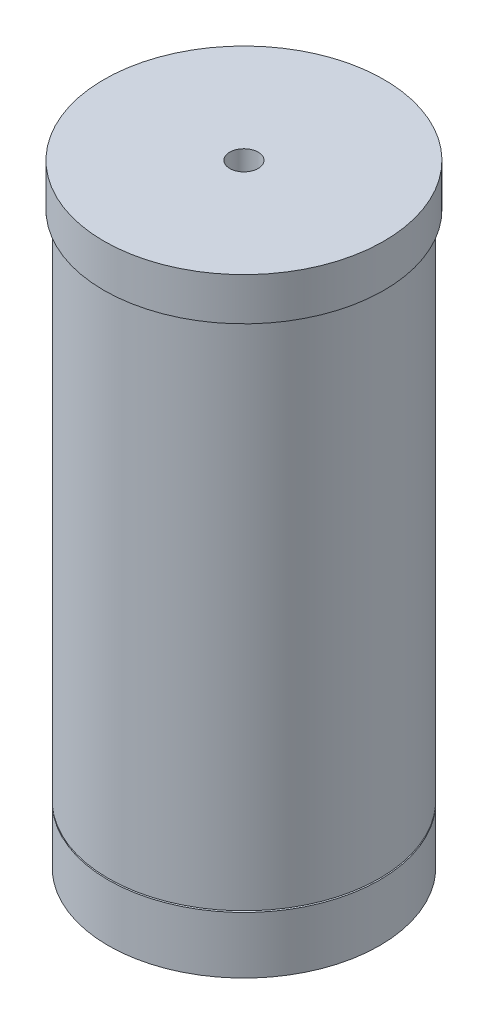
from build123d import *

# Parameters (mm, degrees)
SKETCH1_R             = 47.75
SKETCH1_R_2           = 5
SKETCH1_R_3           = 6
BOSS_EXTRUDE1_DEPTH   = 45
SKETCH1_3_R           = 11.5
SKETCH1_3_R_2         = 8.5
CUT_EXTRUDE1_DEPTH    = 5
SKETCH3_R             = 47.75
SKETCH3_R_2           = 5
BOSS_EXTRUDE2_DEPTH   = 10
SKETCH6_R             = 47.75
SKETCH6_R_2           = 42.5
BOSS_EXTRUDE6_DEPTH   = 125
BOSS_EXTRUDE7_DEPTH   = 20
SKETCH7_R             = 11.25
SKETCH7_R_2           = 8.75
BOSS_EXTRUDE8_DEPTH   = 2
BOSS_EXTRUDE8_2_DEPTH = 2
BOSS_EXTRUDE8_3_DEPTH = 2
BOSS_EXTRUDE8_4_DEPTH = 2
BOSS_EXTRUDE8_5_DEPTH = 2
BOSS_EXTRUDE8_6_DEPTH = 2
BOSS_EXTRUDE8_7_DEPTH = 2
BOSS_EXTRUDE8_8_DEPTH = 2
BOSS_EXTRUDE9_START   = -20
SKETCH7_4_R           = 47.75
BOSS_EXTRUDE9_DEPTH   = 20
SKETCH8_R             = 49.28
SKETCH8_R_2           = 5
BOSS_EXTRUDE10_DEPTH  = 15
BOSS_EXTRUDE11_START  = -25
SKETCH8_4_R           = 5
BOSS_EXTRUDE11_DEPTH  = 25


with BuildPart() as part:
    # Sketch1 → Boss-Extrude1 (new body)
    with BuildSketch(Plane(origin=(0, 0, 0), x_dir=(1, 0, 0), z_dir=(0, 1, 0))):
        Circle(SKETCH1_R)
        Circle(SKETCH1_R_2, mode=Mode.SUBTRACT)
        with Locations((-33, 0)):
            Circle(SKETCH1_R_3, mode=Mode.SUBTRACT)
        with Locations((-23.334523779, -23.334523779)):
            Circle(SKETCH1_R_3, mode=Mode.SUBTRACT)
        with Locations((0, -33)):
            Circle(SKETCH1_R_3, mode=Mode.SUBTRACT)
        with Locations((23.334523779, -23.334523779)):
            Circle(SKETCH1_R_3, mode=Mode.SUBTRACT)
        with Locations((0, 33)):
            Circle(SKETCH1_R_3, mode=Mode.SUBTRACT)
        with Locations((23.334523779, 23.334523779)):
            Circle(SKETCH1_R_3, mode=Mode.SUBTRACT)
        with Locations((33, 0)):
            Circle(SKETCH1_R_3, mode=Mode.SUBTRACT)
        with Locations((-23.334523779, 23.334523779)):
            Circle(SKETCH1_R_3, mode=Mode.SUBTRACT)
    extrude(amount=BOSS_EXTRUDE1_DEPTH)

    # Sketch1<3> → Cut-Extrude1 (cut)
    # profile 1 of 8: a face of its own
    with BuildSketch(Plane(origin=(0, 0, 0), x_dir=(1, 0, 0), z_dir=(0, 1, 0))):
        with Locations((-23.334523779, 23.334523779)):
            Circle(SKETCH1_3_R)
        with Locations((-23.334523779, 23.334523779)):
            Circle(SKETCH1_3_R_2, mode=Mode.SUBTRACT)
    # profile 2 of 8: a face of its own
    with BuildSketch(Plane(origin=(0, 0, 0), x_dir=(1, 0, 0), z_dir=(0, 1, 0))):
        with Locations((0, 33)):
            Circle(SKETCH1_3_R)
        with Locations((0, 33)):
            Circle(SKETCH1_3_R_2, mode=Mode.SUBTRACT)
    # profile 3 of 8: a face of its own
    with BuildSketch(Plane(origin=(0, 0, 0), x_dir=(1, 0, 0), z_dir=(0, 1, 0))):
        with Locations((23.334523779, 23.334523779)):
            Circle(SKETCH1_3_R)
        with Locations((23.334523779, 23.334523779)):
            Circle(SKETCH1_3_R_2, mode=Mode.SUBTRACT)
    # profile 4 of 8: a face of its own
    with BuildSketch(Plane(origin=(0, 0, 0), x_dir=(1, 0, 0), z_dir=(0, 1, 0))):
        with Locations((33, 0)):
            Circle(SKETCH1_3_R)
        with Locations((33, 0)):
            Circle(SKETCH1_3_R_2, mode=Mode.SUBTRACT)
    # profile 5 of 8: a face of its own
    with BuildSketch(Plane(origin=(0, 0, 0), x_dir=(1, 0, 0), z_dir=(0, 1, 0))):
        with Locations((23.334523779, -23.334523779)):
            Circle(SKETCH1_3_R)
        with Locations((23.334523779, -23.334523779)):
            Circle(SKETCH1_3_R_2, mode=Mode.SUBTRACT)
    # profile 6 of 8: a face of its own
    with BuildSketch(Plane(origin=(0, 0, 0), x_dir=(1, 0, 0), z_dir=(0, 1, 0))):
        with Locations((0, -33)):
            Circle(SKETCH1_3_R)
        with Locations((0, -33)):
            Circle(SKETCH1_3_R_2, mode=Mode.SUBTRACT)
    # profile 7 of 8: a face of its own
    with BuildSketch(Plane(origin=(0, 0, 0), x_dir=(1, 0, 0), z_dir=(0, 1, 0))):
        with Locations((-23.334523779, -23.334523779)):
            Circle(SKETCH1_3_R)
        with Locations((-23.334523779, -23.334523779)):
            Circle(SKETCH1_3_R_2, mode=Mode.SUBTRACT)
    # profile 8 of 8: a face of its own
    with BuildSketch(Plane(origin=(0, 0, 0), x_dir=(1, 0, 0), z_dir=(0, 1, 0))):
        with Locations((-33, 0)):
            Circle(SKETCH1_3_R)
        with Locations((-33, 0)):
            Circle(SKETCH1_3_R_2, mode=Mode.SUBTRACT)
    extrude(amount=CUT_EXTRUDE1_DEPTH, mode=Mode.SUBTRACT)

    # Sketch3 → Boss-Extrude2 (add)
    with BuildSketch(Plane(origin=(0, 45, 0), x_dir=(1, 0, 0), z_dir=(0, 1, 0))):
        Circle(SKETCH3_R)
        Circle(SKETCH3_R_2, mode=Mode.SUBTRACT)
    extrude(amount=BOSS_EXTRUDE2_DEPTH)

    # Sketch6 → Boss-Extrude6 (add)
    # profile 1 of 2: a face of its own
    with BuildSketch(Plane(origin=(0, 55, 0), x_dir=(1, 0, 0), z_dir=(0, 1, 0))):
        Circle(SKETCH6_R)
        Circle(SKETCH6_R_2, mode=Mode.SUBTRACT)
    # profile 2 of 2: a face of its own
    with BuildSketch(Plane(origin=(0, 55, 0), x_dir=(1, 0, 0), z_dir=(0, 1, 0))):
        with BuildLine():
            ThreePointArc((15, 39.497626511), (0, 42.25), (-15, 39.497626511))
            Line((-15, 39.497626511), (-15, -39.497626511))
            ThreePointArc((-15, -39.497626511), (0, -42.25), (15, -39.497626511))
            Line((15, -39.497626511), (15, 39.497626511))
        make_face()
        with BuildLine():
            Line((-10, -34.497626511), (-10, 34.497626511))
            ThreePointArc((-10, 34.497626511), (0, 35.917770461), (10, 34.497626511))
            Line((10, 34.497626511), (10, -34.497626511))
            ThreePointArc((10, -34.497626511), (0, -35.917770461), (-10, -34.497626511))
        make_face(mode=Mode.SUBTRACT)
    extrude(amount=BOSS_EXTRUDE6_DEPTH)

    # Sketch6<4> → Boss-Extrude7 (add)
    with BuildSketch(Plane(origin=(0, 55, 0), x_dir=(1, 0, 0), z_dir=(0, 1, 0))):
        with BuildLine():
            ThreePointArc((9.5, 33.997626511), (0, 35.299980289), (-9.5, 33.997626511))
            Line((-9.5, 33.997626511), (-9.5, -33.997626511))
            ThreePointArc((-9.5, -33.997626511), (0, -35.299980289), (9.5, -33.997626511))
            Line((9.5, -33.997626511), (9.5, 33.997626511))
        make_face()
        with BuildLine():
            Line((-5.5, -30.812964253), (-5.5, 30.812964253))
            ThreePointArc((-5.5, 30.812964253), (0, 31.299980289), (5.5, 30.812964253))
            Line((5.5, 30.812964253), (5.5, -30.812964253))
            ThreePointArc((5.5, -30.812964253), (0, -31.299980289), (-5.5, -30.812964253))
        make_face(mode=Mode.SUBTRACT)
    extrude(amount=BOSS_EXTRUDE7_DEPTH)


with BuildPart() as body_2:
    # Sketch7 → Boss-Extrude8 (new body)
    with BuildSketch(Plane(origin=(0, -0.5, 0), x_dir=(1, 0, 0), z_dir=(0, 1, 0))):
        with Locations((0, 33)):
            Circle(SKETCH7_R)
        with Locations((0, 33)):
            Circle(SKETCH7_R_2, mode=Mode.SUBTRACT)
    extrude(amount=BOSS_EXTRUDE8_DEPTH)

    # Sketch7<4> → Boss-Extrude9 (add)
    with BuildSketch(Plane(origin=(0, -0.5, 0), x_dir=(1, 0, 0), z_dir=(0, 1, 0)).offset(BOSS_EXTRUDE9_START)):
        Circle(SKETCH7_4_R)
    extrude(amount=BOSS_EXTRUDE9_DEPTH)


with BuildPart() as body_3:
    # Sketch7 → Boss-Extrude8 2 (new body)
    with BuildSketch(Plane(origin=(0, -0.5, 0), x_dir=(1, 0, 0), z_dir=(0, 1, 0))):
        with Locations((23.334523779, 23.334523779)):
            Circle(SKETCH7_R)
        with Locations((23.334523779, 23.334523779)):
            Circle(SKETCH7_R_2, mode=Mode.SUBTRACT)
    extrude(amount=BOSS_EXTRUDE8_2_DEPTH)


with BuildPart() as body_4:
    # Sketch7 → Boss-Extrude8 3 (new body)
    with BuildSketch(Plane(origin=(0, -0.5, 0), x_dir=(1, 0, 0), z_dir=(0, 1, 0))):
        with Locations((33, 0)):
            Circle(SKETCH7_R)
        with Locations((33, 0)):
            Circle(SKETCH7_R_2, mode=Mode.SUBTRACT)
    extrude(amount=BOSS_EXTRUDE8_3_DEPTH)


with BuildPart() as body_5:
    # Sketch7 → Boss-Extrude8 4 (new body)
    with BuildSketch(Plane(origin=(0, -0.5, 0), x_dir=(1, 0, 0), z_dir=(0, 1, 0))):
        with Locations((23.334523779, -23.334523779)):
            Circle(SKETCH7_R)
        with Locations((23.334523779, -23.334523779)):
            Circle(SKETCH7_R_2, mode=Mode.SUBTRACT)
    extrude(amount=BOSS_EXTRUDE8_4_DEPTH)


with BuildPart() as body_6:
    # Sketch7 → Boss-Extrude8 5 (new body)
    with BuildSketch(Plane(origin=(0, -0.5, 0), x_dir=(1, 0, 0), z_dir=(0, 1, 0))):
        with Locations((0, -33)):
            Circle(SKETCH7_R)
        with Locations((0, -33)):
            Circle(SKETCH7_R_2, mode=Mode.SUBTRACT)
    extrude(amount=BOSS_EXTRUDE8_5_DEPTH)


with BuildPart() as body_7:
    # Sketch7 → Boss-Extrude8 6 (new body)
    with BuildSketch(Plane(origin=(0, -0.5, 0), x_dir=(1, 0, 0), z_dir=(0, 1, 0))):
        with Locations((-23.334523779, -23.334523779)):
            Circle(SKETCH7_R)
        with Locations((-23.334523779, -23.334523779)):
            Circle(SKETCH7_R_2, mode=Mode.SUBTRACT)
    extrude(amount=BOSS_EXTRUDE8_6_DEPTH)


with BuildPart() as body_8:
    # Sketch7 → Boss-Extrude8 7 (new body)
    with BuildSketch(Plane(origin=(0, -0.5, 0), x_dir=(1, 0, 0), z_dir=(0, 1, 0))):
        with Locations((-33, 0)):
            Circle(SKETCH7_R)
        with Locations((-33, 0)):
            Circle(SKETCH7_R_2, mode=Mode.SUBTRACT)
    extrude(amount=BOSS_EXTRUDE8_7_DEPTH)


with BuildPart() as body_9:
    # Sketch7 → Boss-Extrude8 8 (new body)
    with BuildSketch(Plane(origin=(0, -0.5, 0), x_dir=(1, 0, 0), z_dir=(0, 1, 0))):
        with Locations((-23.334523779, 23.334523779)):
            Circle(SKETCH7_R)
        with Locations((-23.334523779, 23.334523779)):
            Circle(SKETCH7_R_2, mode=Mode.SUBTRACT)
    extrude(amount=BOSS_EXTRUDE8_8_DEPTH)


with BuildPart() as body_10:
    # Sketch8 → Boss-Extrude10 (new body)
    with BuildSketch(Plane(origin=(0, 180, 0), x_dir=(1, 0, 0), z_dir=(0, 1, 0))):
        Circle(SKETCH8_R)
        Circle(SKETCH8_R_2, mode=Mode.SUBTRACT)
    extrude(amount=BOSS_EXTRUDE10_DEPTH)

    # Sketch8<4> → Boss-Extrude11 (add)
    with BuildSketch(Plane(origin=(0, 180, 0), x_dir=(1, 0, 0), z_dir=(0, 1, 0)).offset(BOSS_EXTRUDE11_START)):
        with BuildLine():
            ThreePointArc((9.5, 33.997626511), (0, 35.299980289), (-9.5, 33.997626511))
            Line((-9.5, 33.997626511), (-9.5, -33.997626511))
            ThreePointArc((-9.5, -33.997626511), (0, -35.299980289), (9.5, -33.997626511))
            Line((9.5, -33.997626511), (9.5, 33.997626511))
        make_face()
        Circle(SKETCH8_4_R, mode=Mode.SUBTRACT)
    extrude(amount=BOSS_EXTRUDE11_DEPTH)


solid = Compound([part.part, body_2.part, body_3.part, body_4.part, body_5.part, body_6.part, body_7.part, body_8.part, body_9.part, body_10.part])
